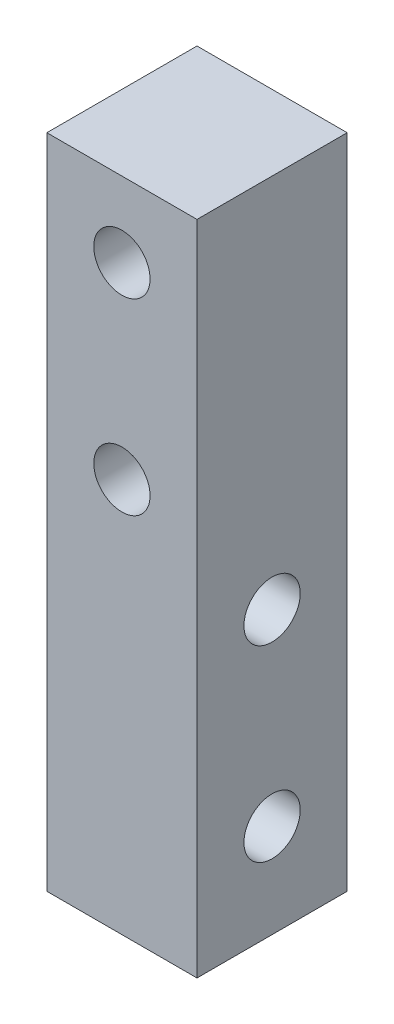
from build123d import *

# Parameters (mm, degrees)
SKETCH1_W           = 8
SKETCH1_H           = 8
BOSS_EXTRUDE1_DEPTH = 35
SKETCH2_R           = 1.5
CUT_EXTRUDE1_DEPTH  = 37.124783736
SKETCH3_R           = 1.5
CUT_EXTRUDE2_DEPTH  = 37.124783736


with BuildPart() as part:
    # Sketch1 → Boss-Extrude1 (new body)
    with BuildSketch(Plane(origin=(0, 0, 0), x_dir=(1, 0, 0), z_dir=(0, 1, 0))):
        Rectangle(SKETCH1_W, SKETCH1_H)
    extrude(amount=BOSS_EXTRUDE1_DEPTH)

    # Sketch2 → Cut-Extrude1 (cut, through all)
    with BuildSketch(Plane(origin=(0, 0, -4), x_dir=(-1, 0, 0), z_dir=(0, 0, -1))):
        with Locations((0, 31)):
            Circle(SKETCH2_R)
        with Locations((0, 21)):
            Circle(SKETCH2_R)
    extrude(amount=-CUT_EXTRUDE1_DEPTH, mode=Mode.SUBTRACT)

    # Sketch3 → Cut-Extrude2 (cut, through all)
    with BuildSketch(Plane(origin=(4, 0, 0), x_dir=(0, 0, -1), z_dir=(1, 0, 0))):
        with Locations((0, 15)):
            Circle(SKETCH3_R)
        with Locations((0, 5)):
            Circle(SKETCH3_R)
    extrude(amount=-CUT_EXTRUDE2_DEPTH, mode=Mode.SUBTRACT)


solid = part.part
